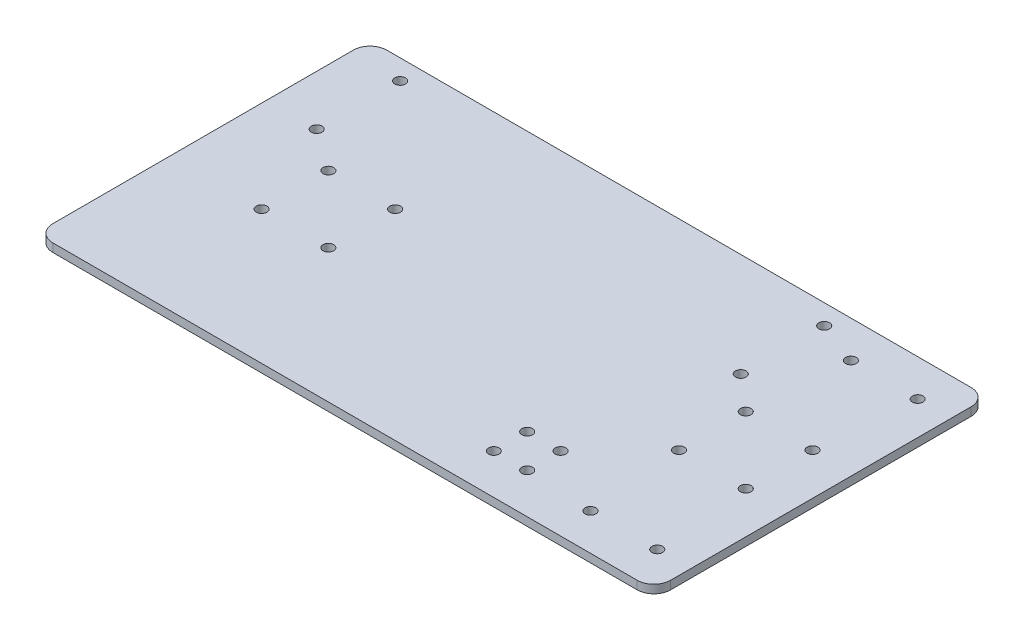
from build123d import *

# Parameters (mm, degrees)
SKETCH1_W           = 234.95
SKETCH1_H           = 127
SKETCH1_R           = 2.032
BOSS_EXTRUDE1_DEPTH = 3.175
FILLET1_R           = 6.35


with BuildPart() as part:
    # Sketch1 → Boss-Extrude1 (new body)
    with BuildSketch(Plane(origin=(0, 0, 0), x_dir=(1, 0, 0), z_dir=(0, 1, 0))):
        Rectangle(SKETCH1_W, SKETCH1_H)
        with Locations(Location((79.375, 49.53, 0), (0, 0, 270))):
            Circle(SKETCH1_R, mode=Mode.SUBTRACT)
        with Locations(Location((79.375, -49.53, 0), (0, 0, 270))):
            Circle(SKETCH1_R, mode=Mode.SUBTRACT)
        with Locations(Location((104.775, -49.53, 0), (0, 0, 270))):
            Circle(SKETCH1_R, mode=Mode.SUBTRACT)
        with Locations(Location((104.775, 49.53, 0), (0, 0, 270))):
            Circle(SKETCH1_R, mode=Mode.SUBTRACT)
        with Locations(Location((53.975, -35.4965, 0), (0, 0, 270))):
            Circle(SKETCH1_R, mode=Mode.SUBTRACT)
        with Locations(Location((41.275, -35.4965, 0), (0, 0, 270))):
            Circle(SKETCH1_R, mode=Mode.SUBTRACT)
        with Locations(Location((41.275, -48.1965, 0), (0, 0, 270))):
            Circle(SKETCH1_R, mode=Mode.SUBTRACT)
        with Locations(Location((53.975, -48.1965, 0), (0, 0, 270))):
            Circle(SKETCH1_R, mode=Mode.SUBTRACT)
        with Locations(Location((-98.425, 55.88, 0), (0, 0, 270))):
            Circle(SKETCH1_R, mode=Mode.SUBTRACT)
        with Locations(Location((-98.425, 24.13, 0), (0, 0, 270))):
            Circle(SKETCH1_R, mode=Mode.SUBTRACT)
        with Locations(Location((62.865, 55.88, 0), (0, 0, 270))):
            Circle(SKETCH1_R, mode=Mode.SUBTRACT)
        with Locations(Location((62.865, 24.13, 0), (0, 0, 270))):
            Circle(SKETCH1_R, mode=Mode.SUBTRACT)
        with Locations(Location((-82.55, 12.7, 0), (0, 0, 270))):
            Circle(SKETCH1_R, mode=Mode.SUBTRACT)
        with Locations(Location((-57.15, 12.7, 0), (0, 0, 270))):
            Circle(SKETCH1_R, mode=Mode.SUBTRACT)
        with Locations(Location((-82.55, -12.7, 0), (0, 0, 270))):
            Circle(SKETCH1_R, mode=Mode.SUBTRACT)
        with Locations(Location((-57.15, -12.7, 0), (0, 0, 270))):
            Circle(SKETCH1_R, mode=Mode.SUBTRACT)
        with Locations(Location((76.2, -12.7, 0), (0, 0, 270))):
            Circle(SKETCH1_R, mode=Mode.SUBTRACT)
        with Locations(Location((101.6, -12.7, 0), (0, 0, 270))):
            Circle(SKETCH1_R, mode=Mode.SUBTRACT)
        with Locations(Location((76.2, 12.7, 0), (0, 0, 270))):
            Circle(SKETCH1_R, mode=Mode.SUBTRACT)
        with Locations(Location((101.6, 12.7, 0), (0, 0, 270))):
            Circle(SKETCH1_R, mode=Mode.SUBTRACT)
    extrude(amount=BOSS_EXTRUDE1_DEPTH)

    # Fillet1
    fillet1_edges = [part.edges().sort_by_distance(p)[0] for p in [
        (117.475, 1.5875, 63.5),
        (-117.475, 1.5875, 63.5),
        (-117.475, 1.5875, -63.5),
        (117.475, 1.5875, -63.5),
    ]]
    fillet(fillet1_edges, radius=FILLET1_R)


solid = part.part
